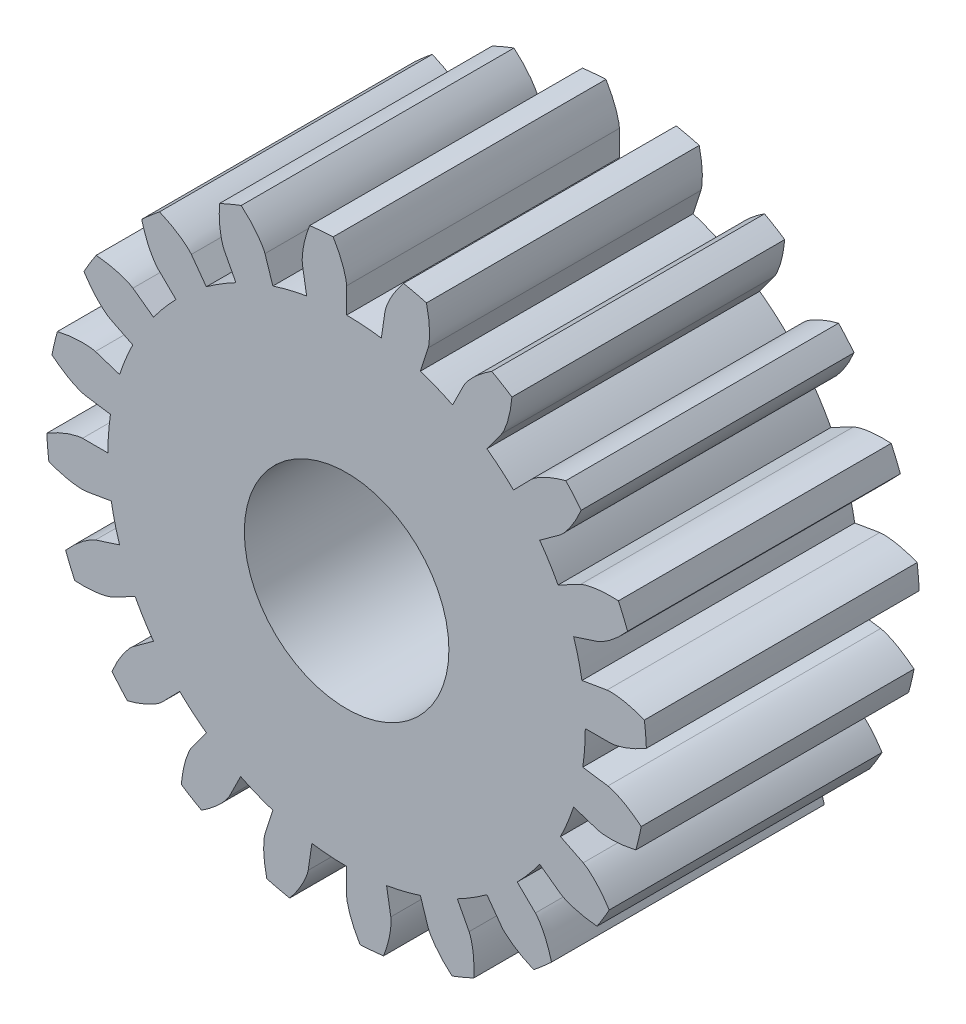
from build123d import *

# Parameters (mm, degrees)
SKETCH1_R           = 13.97
BOSS_EXTRUDE1_DEPTH = 12.7
CUT_EXTRUDE1_DEPTH  = 24.486417351
CIRPATTERN1_COUNT   = 20
SKETCH3_R           = 11.1125
BOSS_EXTRUDE2_DEPTH = 12.7
SKETCH5_R           = 4.7625
CUT_EXTRUDE2_DEPTH  = 24.469801


with BuildPart() as part:
    # Sketch1 → Boss-Extrude1 (new body)
    with BuildSketch(Plane.XY):
        Circle(SKETCH1_R)
    extrude(amount=-BOSS_EXTRUDE1_DEPTH)

    # Sketch2 → Cut-Extrude1 (cut, symmetric)
    with BuildSketch(Plane.XY):
        with BuildLine():
            Line((12.295475033, 0), (5.55625, 0))
            ThreePointArc((5.55625, 0), (5.541453982, -0.405218246), (5.49714473, -0.80827834))
            Line((5.49714473, -0.80827834), (12.164680456, -1.788646326))
            add(Edge.make_bspline(
                [(12.164680456, -1.788646326), (12.20193536, -1.795787888), (12.305265602, -1.820722525), (12.496994196, -1.887758059), (12.797693593, -2.023399539), (13.152869867, -2.22827899), (13.432706219, -2.423466211), (13.625683304, -2.573746739), (13.716709455, -2.648165726)],
                knots=[0, 0, 0, 0, 0, 0.005604071, 0.015718253, 0.029959921, 0.048733673, 0.066120148, 0.066120148, 0.066120148, 0.066120148, 0.066120148], degree=4))
            ThreePointArc((13.716709455, -2.648165726), (13.906533197, -1.330125728), (13.97, 0))
            ThreePointArc((13.97, 0), (13.966507082, 0.312377867), (13.956030074, 0.624599527))
            add(Edge.make_bspline(
                [(12.295475033, 0), (12.33337253, 0.00164605), (12.439230874, 0.011283794), (12.638671719, 0.049715103), (12.955904417, 0.140170364), (13.337106668, 0.291202211), (13.642360486, 0.443604775), (13.855146351, 0.564213929), (13.956030074, 0.624599527)],
                knots=[0, 0, 0, 0, 0, 0.005604071, 0.015718253, 0.029959921, 0.048733673, 0.066120148, 0.066120148, 0.066120148, 0.066120148, 0.066120148], degree=4))
        make_face()
    cut_extrude1 = extrude(amount=CUT_EXTRUDE1_DEPTH, both=True, mode=Mode.SUBTRACT)

    # CirPattern1: Cut-Extrude1 ×20 about axis
    cirpattern1_axis = Axis((0, 0, -12.7), (0, 0, 1))
    for i in range(1, CIRPATTERN1_COUNT):
        add(cut_extrude1.rotate(cirpattern1_axis, i * 360 / CIRPATTERN1_COUNT), mode=Mode.SUBTRACT)

    # Sketch3 → Boss-Extrude2 (add)
    with BuildSketch(Plane.XY):
        Circle(SKETCH3_R)
    extrude(amount=-BOSS_EXTRUDE2_DEPTH)

    # Sketch5 → Cut-Extrude2 (cut, through all)
    with BuildSketch(Plane.XY):
        Circle(SKETCH5_R)
    extrude(amount=-CUT_EXTRUDE2_DEPTH, mode=Mode.SUBTRACT)


solid = part.part
